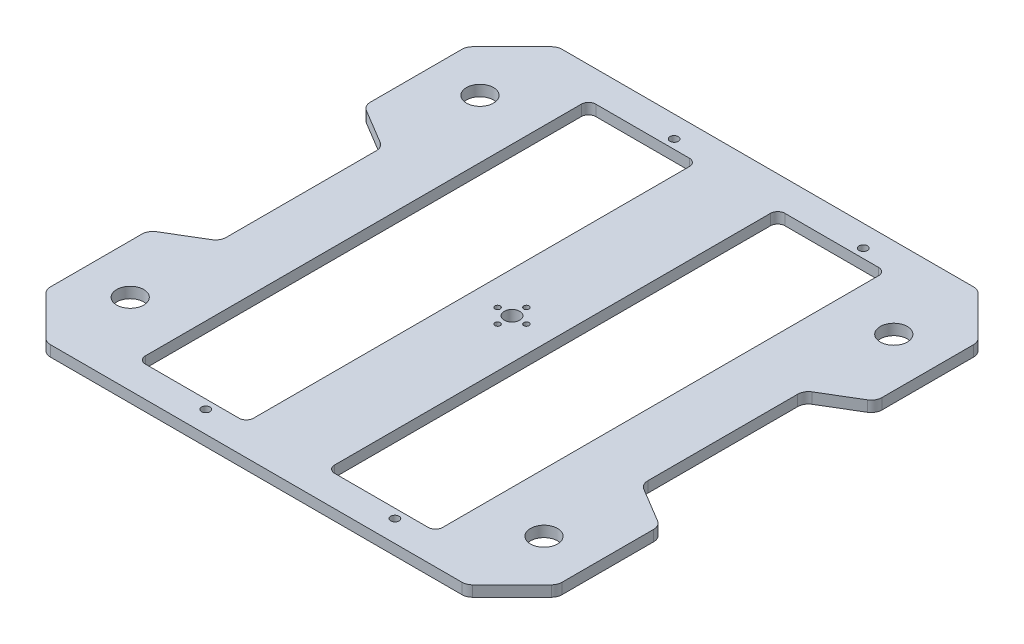
from build123d import *

# Parameters (mm, degrees)
BOSS_EXTRU_1_DEPTH                   = 6
ENL_V_MAT_EXTRU_10_REACH             = 214.217
ESQUISSE12_R                         = 7.5
SYM_TRIE10_COPY_1_REACH              = 214.217
SYM_TRIE10_COPY_1_SKETCH_R           = 7.5
ENL_V_MAT_EXTRU_11_REACH             = 214.217
ESQUISSE13_R                         = 4.3
ESQUISSE13_R_2                       = 1.5
ENL_V_MAT_EXTRU_12_REACH             = 214.217
CONG_1_R                             = 4
CONG_1_OF_SYM_TRIE11_R               = 4
ENL_V_MAT_EXTRU_13_REACH             = 214.217
ESQUISSE15_R                         = 2.3
ENL_V_MAT_EXTRU_13_DIRECTION_2_DEPTH = 213.216870206
R_P_TITION_LIN_AIRE1_COUNT           = 2
R_P_TITION_LIN_AIRE1_PITCH           = 105
ENL_V_MAT_EXTRU_14_DEPTH             = 24
ENL_V_MAT_EXTRU_15_REACH             = 202.908
ESQUISSE17_W                         = 25
ESQUISSE17_H                         = 45
CONG_2_R                             = 6


with BuildPart() as part:
    # Esquisse1 → Boss.-Extru.1 (new body)
    with BuildSketch(Plane(origin=(0, 0, 0), x_dir=(1, 0, 0), z_dir=(0, 1, 0))):
        Polygon((-150, 0), (-150, 120), (-120, 150), (0, 150), (120, 150), (150, 120), (150, 0), (150, -120), (120, -150), (0, -150), (-120, -150), (-150, -120), align=None)
    extrude(amount=BOSS_EXTRU_1_DEPTH)

    # Esquisse12 → Enlèv. mat.-Extru.10 (cut, up to next)
    with BuildSketch(Plane(origin=(0, 6, 0), x_dir=(1, 0, 0), z_dir=(0, 1, 0)), mode=Mode.PRIVATE) as enl_v_mat_extru_10_sk1:
        with Locations(Location((-114.854021031, 97.087596514, 0), (0, 0, 270))):
            Circle(ESQUISSE12_R)
    enl_v_mat_extru_10_tool1 = extrude(enl_v_mat_extru_10_sk1.sketch, amount=-ENL_V_MAT_EXTRU_10_REACH, mode=Mode.PRIVATE) & part.part
    enl_v_mat_extru_10 = enl_v_mat_extru_10_tool1.solids().sort_by_distance((-114.854021, 6, -97.087597))[0]
    add(enl_v_mat_extru_10, mode=Mode.SUBTRACT)

    # Symétrie9: Enlèv. mat.-Extru.10 across plane
    add(enl_v_mat_extru_10.mirror(Plane(origin=(0, 0, 0), x_dir=(0, 0, 1), z_dir=(1, 0, 0))), mode=Mode.SUBTRACT)

    # Symétrie10: Enlèv. mat.-Extru.10 across plane
    add(enl_v_mat_extru_10.mirror(Plane.XY), mode=Mode.SUBTRACT)

    # Symétrie10 copy 1 sketch → Symétrie10 copy 1 (cut, up to next)
    with BuildSketch(Plane(origin=(0, 6, 0), x_dir=(-1, 0, 0), z_dir=(0, 1, 0)), mode=Mode.PRIVATE) as sym_trie10_copy_1_sk1:
        with Locations(Location((-114.854021031, 97.087596514, 0), (0, 0, 270))):
            Circle(SYM_TRIE10_COPY_1_SKETCH_R)
    sym_trie10_copy_1_tool1 = extrude(sym_trie10_copy_1_sk1.sketch, amount=-SYM_TRIE10_COPY_1_REACH, mode=Mode.PRIVATE) & part.part
    add(sym_trie10_copy_1_tool1.solids().sort_by_distance((114.854021, 6, 97.087597))[0], mode=Mode.SUBTRACT)

    # Esquisse13 → Enlèv. mat.-Extru.11 (cut, up to next)
    with BuildSketch(Plane(origin=(0, 6, 0), x_dir=(1, 0, 0), z_dir=(0, 1, 0)), mode=Mode.PRIVATE) as enl_v_mat_extru_11_sk1:
        with Locations(Location((0, 0, 0), (0, 0, 270))):
            Circle(ESQUISSE13_R)
    enl_v_mat_extru_11_tool1 = extrude(enl_v_mat_extru_11_sk1.sketch, amount=-ENL_V_MAT_EXTRU_11_REACH, mode=Mode.PRIVATE) & part.part
    # Esquisse13 → Enlèv. mat.-Extru.11 (cut, up to next)
    with BuildSketch(Plane(origin=(0, 6, 0), x_dir=(1, 0, 0), z_dir=(0, 1, 0)), mode=Mode.PRIVATE) as enl_v_mat_extru_11_sk2:
        with Locations(Location((8, 0, 0), (0, 0, 270))):
            Circle(ESQUISSE13_R_2)
    enl_v_mat_extru_11_tool2 = extrude(enl_v_mat_extru_11_sk2.sketch, amount=-ENL_V_MAT_EXTRU_11_REACH, mode=Mode.PRIVATE) & part.part
    # Esquisse13 → Enlèv. mat.-Extru.11 (cut, up to next)
    with BuildSketch(Plane(origin=(0, 6, 0), x_dir=(1, 0, 0), z_dir=(0, 1, 0)), mode=Mode.PRIVATE) as enl_v_mat_extru_11_sk3:
        with Locations(Location((0, -8, 0), (0, 0, 270))):
            Circle(ESQUISSE13_R_2)
    enl_v_mat_extru_11_tool3 = extrude(enl_v_mat_extru_11_sk3.sketch, amount=-ENL_V_MAT_EXTRU_11_REACH, mode=Mode.PRIVATE) & part.part
    # Esquisse13 → Enlèv. mat.-Extru.11 (cut, up to next)
    with BuildSketch(Plane(origin=(0, 6, 0), x_dir=(1, 0, 0), z_dir=(0, 1, 0)), mode=Mode.PRIVATE) as enl_v_mat_extru_11_sk4:
        with Locations(Location((0, 8, 0), (0, 0, 270))):
            Circle(ESQUISSE13_R_2)
    enl_v_mat_extru_11_tool4 = extrude(enl_v_mat_extru_11_sk4.sketch, amount=-ENL_V_MAT_EXTRU_11_REACH, mode=Mode.PRIVATE) & part.part
    # Esquisse13 → Enlèv. mat.-Extru.11 (cut, up to next)
    with BuildSketch(Plane(origin=(0, 6, 0), x_dir=(1, 0, 0), z_dir=(0, 1, 0)), mode=Mode.PRIVATE) as enl_v_mat_extru_11_sk5:
        with Locations(Location((-8, 0, 0), (0, 0, 270))):
            Circle(ESQUISSE13_R_2)
    enl_v_mat_extru_11_tool5 = extrude(enl_v_mat_extru_11_sk5.sketch, amount=-ENL_V_MAT_EXTRU_11_REACH, mode=Mode.PRIVATE) & part.part
    add(enl_v_mat_extru_11_tool1.solids().sort_by_distance((0, 6, 0))[0], mode=Mode.SUBTRACT)
    add(enl_v_mat_extru_11_tool2.solids().sort_by_distance((8, 6, 0))[0], mode=Mode.SUBTRACT)
    add(enl_v_mat_extru_11_tool3.solids().sort_by_distance((0, 6, 8))[0], mode=Mode.SUBTRACT)
    add(enl_v_mat_extru_11_tool4.solids().sort_by_distance((0, 6, -8))[0], mode=Mode.SUBTRACT)
    add(enl_v_mat_extru_11_tool5.solids().sort_by_distance((-8, 6, 0))[0], mode=Mode.SUBTRACT)

    # Esquisse14 → Enlèv. mat.-Extru.12 (cut, up to next)
    with BuildSketch(Plane(origin=(0, 6, 0), x_dir=(1, 0, 0), z_dir=(0, 1, 0)), mode=Mode.PRIVATE) as enl_v_mat_extru_12_sk1:
        Polygon((52.5, -125), (82.5, -125), (82.5, 125), (22.5, 125), (22.5, -125), align=None)
    enl_v_mat_extru_12_tool1 = extrude(enl_v_mat_extru_12_sk1.sketch, amount=-ENL_V_MAT_EXTRU_12_REACH, mode=Mode.PRIVATE) & part.part
    enl_v_mat_extru_12 = enl_v_mat_extru_12_tool1.solids().sort_by_distance((52.5, 6, 0))[0]
    add(enl_v_mat_extru_12, mode=Mode.SUBTRACT)

    # Congé1
    cong_1_edges = [part.edges().sort_by_distance(p)[0] for p in [
        (22.5, 3, -125),
        (82.5, 3, -125),
        (82.5, 3, 125),
        (22.5, 3, 125),
    ]]
    fillet(cong_1_edges, radius=CONG_1_R)

    # Symétrie11: Enlèv. mat.-Extru.12 across plane
    add(enl_v_mat_extru_12.mirror(Plane(origin=(0, 0, 0), x_dir=(0, 0, 1), z_dir=(1, 0, 0))), mode=Mode.SUBTRACT)

    # Congé1 of Symétrie11
    cong_1_of_sym_trie11_edges = [part.edges().sort_by_distance(p)[0] for p in [
        (-22.5, 3, -125),
        (-82.5, 3, -125),
        (-82.5, 3, 125),
        (-22.5, 3, 125),
    ]]
    fillet(cong_1_of_sym_trie11_edges, radius=CONG_1_OF_SYM_TRIE11_R)

    # Esquisse15 → Enlèv. mat.-Extru.13 (cut, up to next)
    with BuildSketch(Plane(origin=(0, 6, 0), x_dir=(1, 0, 0), z_dir=(0, 1, 0)), mode=Mode.PRIVATE) as enl_v_mat_extru_13_sk1:
        with Locations(Location((-40, 130, 0), (0, 0, 90))):
            Circle(ESQUISSE15_R)
    enl_v_mat_extru_13_tool1 = extrude(enl_v_mat_extru_13_sk1.sketch, amount=-ENL_V_MAT_EXTRU_13_REACH, mode=Mode.PRIVATE) & part.part
    # Esquisse15 → Enlèv. mat.-Extru.13 (cut, up to next)
    with BuildSketch(Plane(origin=(0, 6, 0), x_dir=(1, 0, 0), z_dir=(0, 1, 0)), mode=Mode.PRIVATE) as enl_v_mat_extru_13_sk2:
        with Locations(Location((-40, -130, 0), (0, 0, 90))):
            Circle(ESQUISSE15_R)
    enl_v_mat_extru_13_tool2 = extrude(enl_v_mat_extru_13_sk2.sketch, amount=-ENL_V_MAT_EXTRU_13_REACH, mode=Mode.PRIVATE) & part.part
    enl_v_mat_extru_13_1 = enl_v_mat_extru_13_tool1.solids().sort_by_distance((-40, 6, -130))[0]
    add(enl_v_mat_extru_13_1, mode=Mode.SUBTRACT)
    enl_v_mat_extru_13_2 = enl_v_mat_extru_13_tool2.solids().sort_by_distance((-40, 6, 130))[0]
    add(enl_v_mat_extru_13_2, mode=Mode.SUBTRACT)
    enl_v_mat_extru_13 = enl_v_mat_extru_13_1 + enl_v_mat_extru_13_2  # Enlèv. mat.-Extru.13 as one shape, for the pattern or mirror that repeats it

    # Esquisse15 → Enlèv. mat.-Extru.13 direction 2 (cut)
    with BuildSketch(Plane(origin=(0, 6, 0), x_dir=(1, 0, 0), z_dir=(0, 1, 0))):
        with Locations(Location((-40, 130, 0), (0, 0, 90))):
            Circle(ESQUISSE15_R)
        with Locations(Location((-40, -130, 0), (0, 0, 90))):
            Circle(ESQUISSE15_R)
    enl_v_mat_extru_13_direction_2 = extrude(amount=ENL_V_MAT_EXTRU_13_DIRECTION_2_DEPTH, mode=Mode.SUBTRACT)

    # Répétition linéaire1: Enlèv. mat.-Extru.13, Enlèv. mat.-Extru.13 direction 2 ×2
    with Locations(*[(i * R_P_TITION_LIN_AIRE1_PITCH, 0, 0) for i in range(1, R_P_TITION_LIN_AIRE1_COUNT)]):
        add(enl_v_mat_extru_13, mode=Mode.SUBTRACT)
        add(enl_v_mat_extru_13_direction_2, mode=Mode.SUBTRACT)

    # Esquisse16 → Enlèv. mat.-Extru.14 (cut)
    with BuildSketch(Plane(origin=(0, 6, 0), x_dir=(1, 0, 0), z_dir=(0, 1, 0))):
        Polygon((150, 120), (120, 150), (-120, 150), (-150, 120), (-150, -120), (-120, -150), (120, -150), (150, -120), align=None)
        Polygon((-142, 116.686291501), (-116.686291501, 142), (116.686291501, 142), (142, 116.686291501), (142, -116.686291501), (116.686291501, -142), (-116.686291501, -142), (-142, -116.686291501), align=None, mode=Mode.SUBTRACT)
    extrude(amount=-ENL_V_MAT_EXTRU_14_DEPTH, mode=Mode.SUBTRACT)

    # Esquisse17 → Enlèv. mat.-Extru.15 (cut, up to next)
    with BuildSketch(Plane(origin=(0, 6, 0), x_dir=(1, 0, 0), z_dir=(0, 1, 0)), mode=Mode.PRIVATE) as enl_v_mat_extru_15_sk1:
        Polygon((-117, -45), (-142, -45), (-142, -60), align=None)
    enl_v_mat_extru_15_tool1 = extrude(enl_v_mat_extru_15_sk1.sketch, amount=-ENL_V_MAT_EXTRU_15_REACH, mode=Mode.PRIVATE) & part.part
    # Esquisse17 → Enlèv. mat.-Extru.15 (cut, up to next)
    with BuildSketch(Plane(origin=(0, 6, 0), x_dir=(1, 0, 0), z_dir=(0, 1, 0)), mode=Mode.PRIVATE) as enl_v_mat_extru_15_sk2:
        with Locations((-129.5, -22.5)):
            Rectangle(ESQUISSE17_W, ESQUISSE17_H)
    enl_v_mat_extru_15_tool2 = extrude(enl_v_mat_extru_15_sk2.sketch, amount=-ENL_V_MAT_EXTRU_15_REACH, mode=Mode.PRIVATE) & part.part
    # Esquisse17 → Enlèv. mat.-Extru.15 (cut, up to next)
    with BuildSketch(Plane(origin=(0, 6, 0), x_dir=(1, 0, 0), z_dir=(0, 1, 0)), mode=Mode.PRIVATE) as enl_v_mat_extru_15_sk3:
        with Locations((-129.5, 22.5)):
            Rectangle(ESQUISSE17_W, ESQUISSE17_H)
    enl_v_mat_extru_15_tool3 = extrude(enl_v_mat_extru_15_sk3.sketch, amount=-ENL_V_MAT_EXTRU_15_REACH, mode=Mode.PRIVATE) & part.part
    # Esquisse17 → Enlèv. mat.-Extru.15 (cut, up to next)
    with BuildSketch(Plane(origin=(0, 6, 0), x_dir=(1, 0, 0), z_dir=(0, 1, 0)), mode=Mode.PRIVATE) as enl_v_mat_extru_15_sk4:
        Polygon((-142, 60), (-142, 45), (-117, 45), align=None)
    enl_v_mat_extru_15_tool4 = extrude(enl_v_mat_extru_15_sk4.sketch, amount=-ENL_V_MAT_EXTRU_15_REACH, mode=Mode.PRIVATE) & part.part
    enl_v_mat_extru_15_1 = enl_v_mat_extru_15_tool1.solids().sort_by_distance((-133.666667, 6, 50))[0]
    add(enl_v_mat_extru_15_1, mode=Mode.SUBTRACT)
    enl_v_mat_extru_15_2 = enl_v_mat_extru_15_tool2.solids().sort_by_distance((-129.5, 6, 22.5))[0]
    add(enl_v_mat_extru_15_2, mode=Mode.SUBTRACT)
    enl_v_mat_extru_15_3 = enl_v_mat_extru_15_tool3.solids().sort_by_distance((-129.5, 6, -22.5))[0]
    add(enl_v_mat_extru_15_3, mode=Mode.SUBTRACT)
    enl_v_mat_extru_15_4 = enl_v_mat_extru_15_tool4.solids().sort_by_distance((-133.666667, 6, -50))[0]
    add(enl_v_mat_extru_15_4, mode=Mode.SUBTRACT)
    enl_v_mat_extru_15 = enl_v_mat_extru_15_1 + enl_v_mat_extru_15_2 + enl_v_mat_extru_15_3 + enl_v_mat_extru_15_4  # Enlèv. mat.-Extru.15 as one shape, for the pattern or mirror that repeats it

    # Symétrie12: Enlèv. mat.-Extru.15 across plane
    add(enl_v_mat_extru_15.mirror(Plane(origin=(0, 0, 0), x_dir=(0, 0, 1), z_dir=(1, 0, 0))), mode=Mode.SUBTRACT)

    # Congé2
    cong_2_edges = [part.edges().sort_by_distance(p)[0] for p in [
        (116.686291501, 3, -142),
        (-116.686291501, 3, -142),
        (-142, 3, -116.686291501),
        (-142, 3, 116.686291501),
        (-116.686291501, 3, 142),
        (116.686291501, 3, 142),
        (142, 3, 116.686291501),
        (142, 3, -116.686291501),
        (-117, 3, 45),
        (-142, 3, 60),
        (-142, 3, -60),
        (-117, 3, -45),
        (142, 3, 60),
        (117, 3, 45),
        (117, 3, -45),
        (142, 3, -60),
    ]]
    fillet(cong_2_edges, radius=CONG_2_R)


solid = part.part
